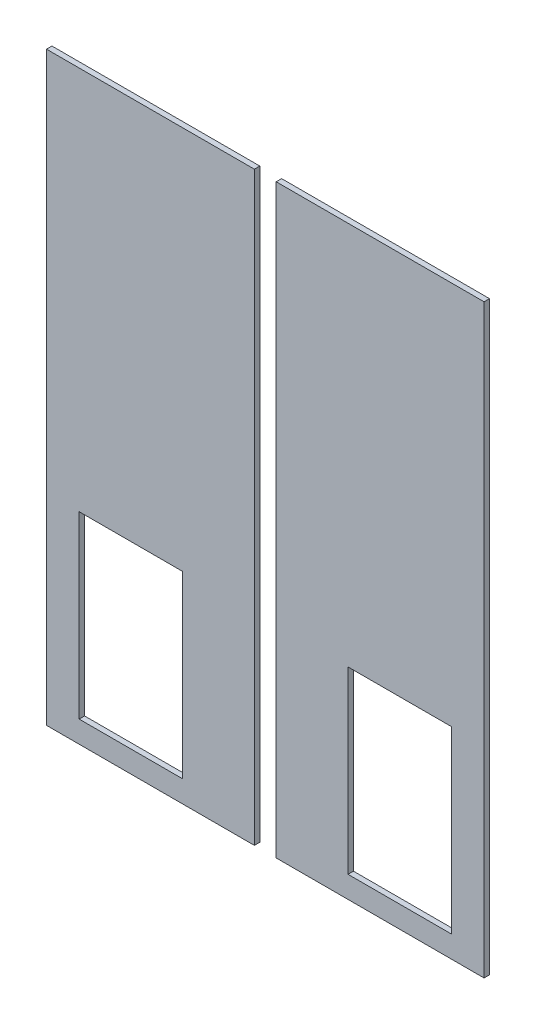
from build123d import *

# Parameters (mm, degrees)
SKETCH1_W             = 242.57
SKETCH1_H             = 683.26
SKETCH1_W_2           = 120.65
SKETCH1_H_2           = 209.55
BOSS_EXTRUDE1_DEPTH   = 6.35
BOSS_EXTRUDE1_2_DEPTH = 6.35


with BuildPart() as part:
    # Sketch1 → Boss-Extrude1 (new body)
    with BuildSketch(Plane.XY):
        with Locations((-133.985, 0)):
            Rectangle(SKETCH1_W, SKETCH1_H)
        with Locations((-156.845, -211.455)):
            Rectangle(SKETCH1_W_2, SKETCH1_H_2, mode=Mode.SUBTRACT)
    extrude(amount=BOSS_EXTRUDE1_DEPTH)


with BuildPart() as body_2:
    # Sketch1 → Boss-Extrude1 2 (new body)
    with BuildSketch(Plane.XY):
        with Locations((133.985, 0)):
            Rectangle(SKETCH1_W, SKETCH1_H)
        with Locations((156.845, -211.455)):
            Rectangle(SKETCH1_W_2, SKETCH1_H_2, mode=Mode.SUBTRACT)
    extrude(amount=BOSS_EXTRUDE1_2_DEPTH)


solid = Compound([part.part, body_2.part])
